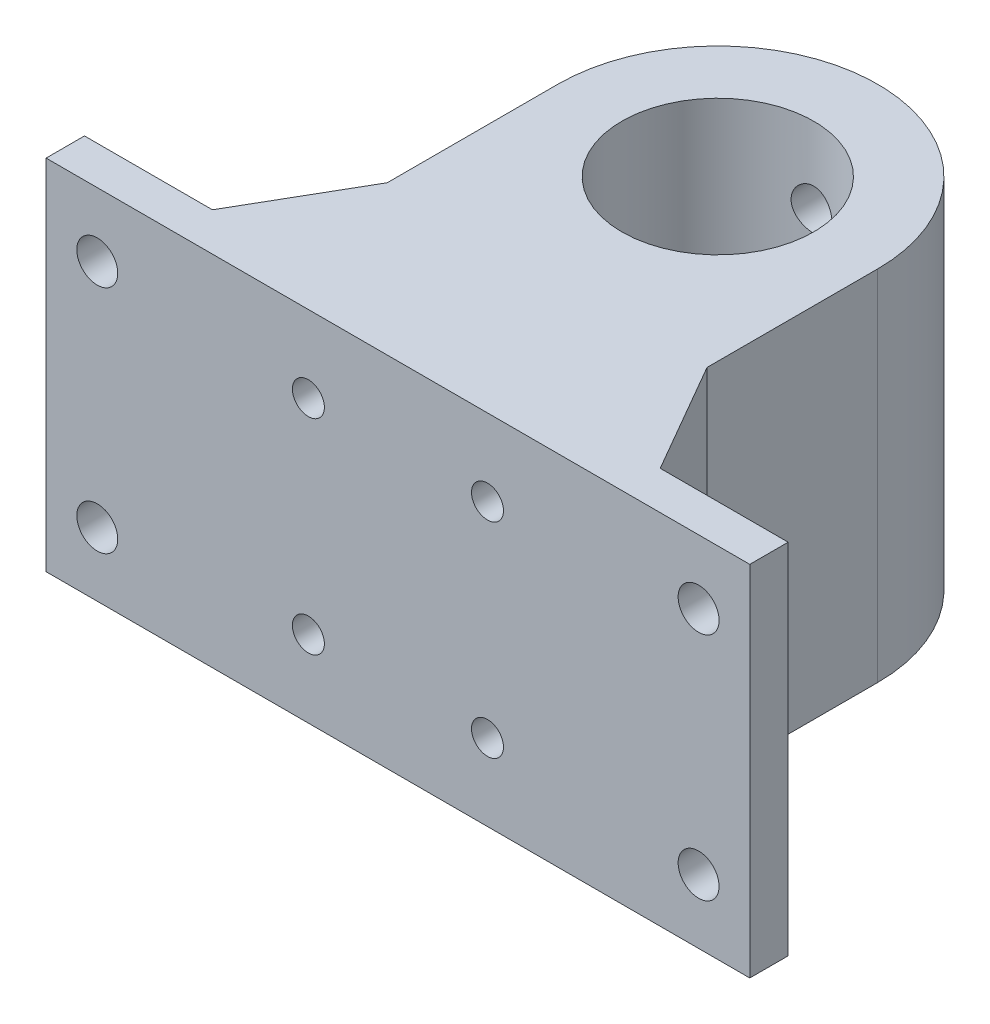
from build123d import *
from OCP.BRepFilletAPI import BRepFilletAPI_MakeChamfer

# Parameters (mm, degrees)
SKETCH_1_R             = 7.5
EXTRUDE_1_DEPTH        = 14
SKETCH_7_R             = 1.6
CUT_EXTRUDE_2_DEPTH    = 32.260998065
HOLE_WIZARD_M3_1_D     = 2.5
HOLE_WIZARD_M3_1_DEPTH = 9.5
HOLE_WIZARD_M3_1_TIP   = 0.751075774
SKETCH_9_W             = 3
SKETCH_9_H             = 28
EXTRUDE_2_DEPTH        = 15
SKETCH_10_R            = 1.6
CUT_EXTRUDE_3_DEPTH    = 47.287147349
CHAMFER_1_SIZE         = 5
CHAMFER_1_SIZE2        = 8.660254038


with BuildPart() as part:
    # 草图1 → 凸台-拉伸1 (new, symmetric)
    with BuildSketch(Plane(origin=(0, 0, 0), x_dir=(1, 0, 0), z_dir=(0, 1, 0))):
        with BuildLine():
            Line((-12.5, -25), (12.5, -25))
            Line((12.5, -25), (12.5, 0))
            ThreePointArc((12.5, 0), (0, 12.5), (-12.5, 0))
            Line((-12.5, 0), (-12.5, -25))
        make_face()
        with Locations(Location((0, 0, 0), (0, 0, 270))):
            Circle(SKETCH_1_R, mode=Mode.SUBTRACT)
    extrude(amount=EXTRUDE_1_DEPTH, both=True)

    # 草图7 → 切除-拉伸2 (cut, through all)
    with BuildSketch(Plane.XY):
        with Locations(Location((0, -8, 0), (0, 0, 90))):
            Circle(SKETCH_7_R)
        with Locations(Location((0, 8, 0), (0, 0, 90))):
            Circle(SKETCH_7_R)
    extrude(amount=-CUT_EXTRUDE_2_DEPTH, mode=Mode.SUBTRACT)

    # M3 螺纹孔1
    with Locations(Plane(origin=(-7, -8, 25), x_dir=(1, 0, 0), z_dir=(0, 0, 1))):
        with Locations((0, 0), (14, 0), (14, 16), (0, 16)):
            Hole(HOLE_WIZARD_M3_1_D / 2, depth=HOLE_WIZARD_M3_1_DEPTH)
            with Locations((0, 0, -(HOLE_WIZARD_M3_1_DEPTH + HOLE_WIZARD_M3_1_TIP / 2))):  # 118° drill point
                Cone(0, HOLE_WIZARD_M3_1_D / 2, HOLE_WIZARD_M3_1_TIP, mode=Mode.SUBTRACT)

    # 草图9 → 凸台-拉伸2 (add)
    with BuildSketch(Plane(origin=(12.5, 0, 0), x_dir=(0, 0, -1), z_dir=(1, 0, 0))):
        with Locations((-23.5, 0)):
            Rectangle(SKETCH_9_W, SKETCH_9_H)
    extrude_2 = extrude(amount=EXTRUDE_2_DEPTH)

    # 草图10 → 切除-拉伸3 (cut, through all)
    with BuildSketch(Plane(origin=(0, 0, 22), x_dir=(-1, 0, 0), z_dir=(0, 0, -1))):
        with Locations((-23.5, 9)):
            Circle(SKETCH_10_R)
        with Locations(Location((-23.5, -9, 0), (0, 0, 180))):
            Circle(SKETCH_10_R)
    cut_extrude_3 = extrude(amount=-CUT_EXTRUDE_3_DEPTH, mode=Mode.SUBTRACT)

    # 镜向6: 凸台-拉伸2, 切除-拉伸3 across plane
    add(extrude_2.mirror(Plane(origin=(0, 0, 0), x_dir=(0, 0, 1), z_dir=(1, 0, 0))))
    add(cut_extrude_3.mirror(Plane(origin=(0, 0, 0), x_dir=(0, 0, 1), z_dir=(1, 0, 0))), mode=Mode.SUBTRACT)

    # 倒角1: one chamfer whose edges measure the first distance from different faces: ONE call of the kernel's chamfer builder (chamfer() names one face for all edges)
    chamfer_1_edges_1 = [part.edges().sort_by_distance(p)[0] for p in [
        (12.5, 0, 22),
    ]]
    chamfer_1_side_1 = [part.faces().sort_by_distance(p)[0] for p in [
        (19.860620839, 0, 22),
    ]]
    chamfer_1_edges_2 = [part.edges().sort_by_distance(p)[0] for p in [
        (-12.5, 0, 22),
    ]]
    chamfer_1_side_2 = [part.faces().sort_by_distance(p)[0] for p in [
        (-19.860620839, 0, 22),
    ]]
    chamfer_1 = BRepFilletAPI_MakeChamfer(part.part.solid().wrapped)
    for e in chamfer_1_edges_1:
        chamfer_1.Add(CHAMFER_1_SIZE, CHAMFER_1_SIZE2, e.wrapped, chamfer_1_side_1[0].wrapped)  # the first distance lies on this face
    for e in chamfer_1_edges_2:
        chamfer_1.Add(CHAMFER_1_SIZE, CHAMFER_1_SIZE2, e.wrapped, chamfer_1_side_2[0].wrapped)  # the first distance lies on this face
    add(Compound.cast(chamfer_1.Shape()), mode=Mode.REPLACE)


solid = part.part
